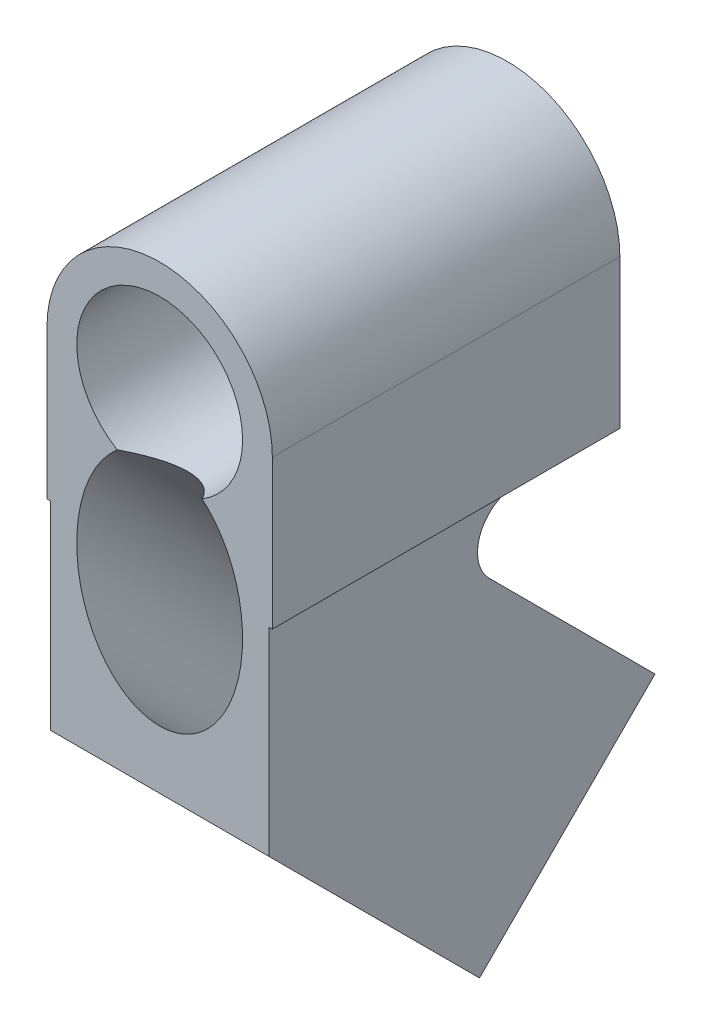
from build123d import *

# Parameters (mm, degrees)
CROQUIS1_R              = 8.35
SALIENTE_EXTRUIR1_DEPTH = 17.5
SALIENTE_EXTRUIR2_DEPTH = 11
CROQUIS4_R              = 8.35
CORTAR_EXTRUIR1_DEPTH   = 55


with BuildPart() as part:
    # Croquis1 → Saliente-Extruir1 (new, symmetric)
    with BuildSketch(Plane.XY):
        with BuildLine():
            Line((-11.35, -15), (11.35, -15))
            Line((11.35, -15), (11.35, 0))
            ThreePointArc((11.35, 0), (0, 11.35), (-11.35, 0))
            Line((-11.35, 0), (-11.35, -15))
        make_face()
        Circle(CROQUIS1_R, mode=Mode.SUBTRACT)
    extrude(amount=SALIENTE_EXTRUIR1_DEPTH, both=True)

    # Croquis2 → Saliente-Extruir2 (add, symmetric)
    with BuildSketch(Plane(origin=(0, 0, 0), x_dir=(0, 0, -1), z_dir=(1, 0, 0))):
        with BuildLine():
            Line((-17.5, -15), (-17.5, -35))
            Line((-17.5, -35), (3.713203436, -56.213203436))
            Line((3.713203436, -56.213203436), (21.390872965, -38.535533906))
            Line((21.390872965, -38.535533906), (4.683766184, -21.828427125))
            ThreePointArc((4.683766184, -21.828427125), (3.816675179, -17.469266271), (7.512193309, -15))
            Line((7.512193309, -15), (-17.5, -15))
        make_face()
    extrude(amount=SALIENTE_EXTRUIR2_DEPTH, both=True)

    # Croquis4 → Cortar-Extruir1 (cut)
    with BuildSketch(Plane(origin=(0, -29.963203436, -29.963203436), x_dir=(-1, 0, 0), z_dir=(0, -0.7071067811865459, -0.7071067811865492))):
        with Locations(Location((0, -24.623106012, 0), (0, 0, 90))):
            Circle(CROQUIS4_R)
    extrude(amount=-CORTAR_EXTRUIR1_DEPTH, mode=Mode.SUBTRACT)


solid = part.part
